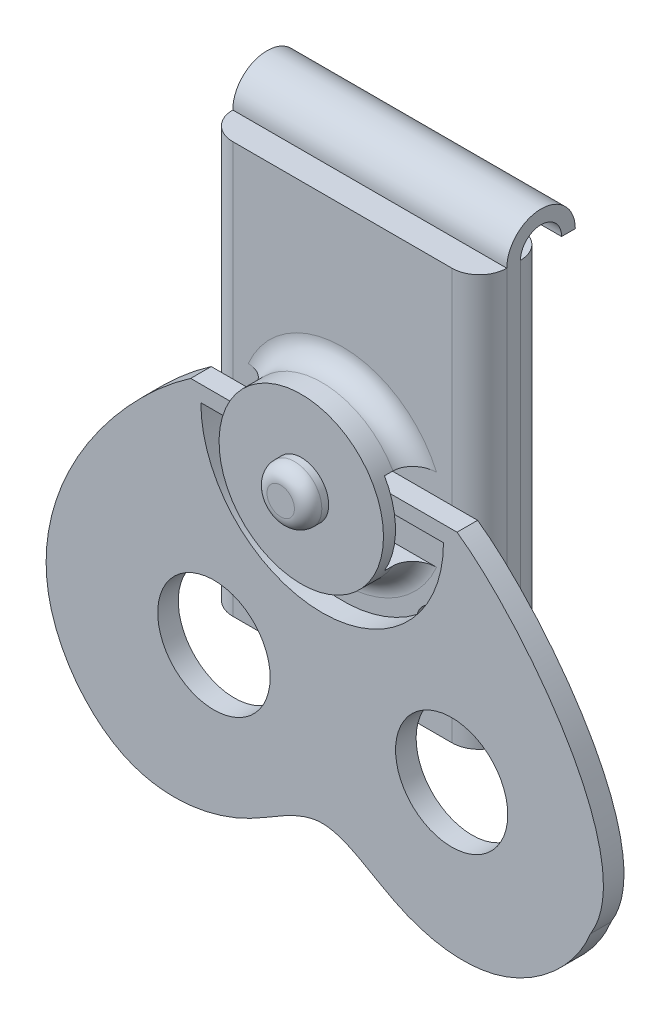
from build123d import *

# Parameters (mm, degrees)
SKETCH_1_W          = 20
SKETCH_1_H          = 30
EXTRUDE_1_DEPTH     = 5
FILLET_1_R          = 2
SKETCH_3_R          = 6
EXTRUDE_2_DEPTH     = 3
SKETCH_6_R          = 2
EXTRUDE_3_DEPTH     = 1.5
FILLET_2_R          = 1
FILLET_3_R          = 1.5
CUT_EXTRUDE_2_REACH = 26.29
SKETCH_8_W          = 2.123495481
SKETCH_8_H          = 6
EXTRUDE_4_DEPTH     = 1.5
SKETCH_11_R         = 4.102803396
SKETCH_11_R_2       = 4.093881939
CUT_EXTRUDE_4_DEPTH = 1.5
CUT_EXTRUDE_5_REACH = 41.076
SKETCH_12_R         = 1.6
SKETCH_15_W         = 20
SKETCH_15_H         = 1


with BuildPart() as part:
    # 草图1 → 凸台-拉伸1 (new body)
    with BuildSketch(Plane.XY):
        with Locations((-0.512048193, -4.728915663)):
            Rectangle(SKETCH_1_W, SKETCH_1_H)
    extrude(amount=EXTRUDE_1_DEPTH)

    # 圆角1
    fillet_1_edges = [part.edges().sort_by_distance(p)[0] for p in [
        (9.487951807, -4.728915663, 5),
        (-10.512048193, -4.728915663, 5),
        (9.487951807, -4.728915663, 0),
        (-10.512048193, -4.728915663, 0),
    ]]
    fillet(fillet_1_edges, radius=FILLET_1_R)

    # 草图3 → 凸台-拉伸2 (add)
    with BuildSketch(Plane.XY.offset(5)):
        with Locations((-0.512048193, -6.192161846)):
            Circle(SKETCH_3_R)
    extrude(amount=EXTRUDE_2_DEPTH)

    # 草图6 → 凸台-拉伸3 (add)
    with BuildSketch(Plane.XY.offset(8)):
        with Locations((-0.512048193, -6.192161846)):
            Circle(SKETCH_6_R)
    extrude(amount=EXTRUDE_3_DEPTH)

    # 圆角2
    fillet_2_edges = [part.edges().sort_by_distance(p)[0] for p in [
        (-2.512048193, -6.192161846, 9.5),
    ]]
    fillet(fillet_2_edges, radius=FILLET_2_R)

    # 圆角3
    fillet_3_edges = [part.edges().sort_by_distance(p)[0] for p in [
        (-6.512048193, -6.192161846, 5),
    ]]
    fillet(fillet_3_edges, radius=FILLET_3_R)

    # 草图8 → 切除-拉伸2 (cut, up to next)
    with BuildSketch(Plane(origin=(0, 0, 0), x_dir=(0, 0, -1), z_dir=(1, 0, 0)), mode=Mode.PRIVATE) as cut_extrude_2_sk1:
        with Locations((-6.061747741, -6.192161846)):
            Rectangle(SKETCH_8_W, SKETCH_8_H)
    cut_extrude_2_tool1 = extrude(cut_extrude_2_sk1.sketch, amount=-CUT_EXTRUDE_2_REACH, mode=Mode.PRIVATE) & part.part
    cut_extrude_2 = cut_extrude_2_tool1.solids().sort_by_distance((0, -6.192162, 6.061748))[0]
    add(cut_extrude_2, mode=Mode.SUBTRACT)

    # 镜向1: 切除-拉伸2 across plane
    add(cut_extrude_2.mirror(Plane(origin=(0, 0, 0), x_dir=(0, 0, 1), z_dir=(1, 0, 0))), mode=Mode.SUBTRACT)

    # 草图10 → 凸台-拉伸4 (add)
    with BuildSketch(Plane.XY.offset(5)):
        with BuildLine():
            Line((-9.340987134, -4.728915663), (9.355589447, -4.728915663))
            add(Edge.make_bspline(
                [(9.355589447, -4.728915663), (13.992546716, -7.945382006), (22.972097945, -19.096110537), (19.084733928, -25.255580428)],
                knots=[0, 0, 0, 0, 0.887388337, 0.887388337, 0.887388337, 0.887388337], degree=3))
            add(Edge.make_bspline(
                [(-10.082914776, -4.728915663), (-15.408926962, -8.375968451), (-24.994806931, -20.22138181), (-15.197101736, -32.678561916), (-6.587465976, -31.626421296), (-0.477412243, -26.61445571), (5.414794623, -31.424474746), (13.293093494, -32.294100029), (18.097699513, -27.767163892), (19.084733928, -25.255580428)],
                knots=[0, 0, 0, 0, 0.234068199, 0.319051753, 0.409665551, 0.46874826, 0.52865283, 0.608525839, 0.694487997, 0.694487997, 0.694487997, 0.694487997], degree=3))
            Line((-10.082914776, -4.728915663), (-9.340987134, -4.728915663))
        make_face()
        with BuildLine():
            Line((-9.340987134, -5.891268969), (8.366352591, -5.891268969))
            ThreePointArc((8.366352591, -5.891268969), (-0.487317271, -14.744938831), (-9.340987134, -5.891268969))
        make_face(mode=Mode.SUBTRACT)
    extrude(amount=EXTRUDE_4_DEPTH)

    # 草图11 → 切除-拉伸4 (cut)
    with BuildSketch(Plane.XY.offset(6.5)):
        with Locations((-8.385806573, -20.733892602)):
            Circle(SKETCH_11_R)
        with Locations((8.963204082, -20.733892602)):
            Circle(SKETCH_11_R_2)
    extrude(amount=-CUT_EXTRUDE_4_DEPTH, mode=Mode.SUBTRACT)

    # 切除-拉伸5: up to this face of the body (flat: up to its plane)
    cut_extrude_5_end = Plane(part.part.faces().sort_by_distance((-0.492684215, -8.944423167, 5))[0])
    # 草图12 → 切除-拉伸5 (cut, up to the picked face)
    with BuildSketch(Plane(origin=(0, 0, 0), x_dir=(-1, 0, 0), z_dir=(0, 0, -1)), mode=Mode.PRIVATE) as cut_extrude_5_sk1:
        with Locations(Location((-6.487951807, -13.298602321, 0), (0, 0, 231.317812547))):
            Circle(SKETCH_12_R)
    cut_extrude_5_tool1 = split(extrude(cut_extrude_5_sk1.sketch, amount=-CUT_EXTRUDE_5_REACH, mode=Mode.PRIVATE), bisect_by=cut_extrude_5_end, keep=Keep.BOTH, mode=Mode.PRIVATE)
    # 草图12 → 切除-拉伸5 (cut, up to the picked face)
    with BuildSketch(Plane(origin=(0, 0, 0), x_dir=(-1, 0, 0), z_dir=(0, 0, -1)), mode=Mode.PRIVATE) as cut_extrude_5_sk2:
        with Locations(Location((7.512048193, -13.298602321, 0), (0, 0, 308.682187453))):
            Circle(SKETCH_12_R)
    cut_extrude_5_tool2 = split(extrude(cut_extrude_5_sk2.sketch, amount=-CUT_EXTRUDE_5_REACH, mode=Mode.PRIVATE), bisect_by=cut_extrude_5_end, keep=Keep.BOTH, mode=Mode.PRIVATE)
    add(cut_extrude_5_tool1.solids().sort_by(Axis((6.487952, -13.298602, 0), (0, 0, 1)))[0], mode=Mode.SUBTRACT)
    add(cut_extrude_5_tool2.solids().sort_by(Axis((-7.512048, -13.298602, 0), (0, 0, 1)))[0], mode=Mode.SUBTRACT)

    # 扫描1: sweep along a path in 草图14
    with BuildLine(Plane(origin=(0, 0, 0), x_dir=(0, 0, -1), z_dir=(1, 0, 0))) as sweep_1_path:
        ThreePointArc((-2.5, 10.271084337), (-0.5, 12.271084337), (1.5, 10.271084337))
    # 草图15 → 扫描1 (sweep)
    with BuildSketch(Plane(origin=(0, 10.271084337, 0), x_dir=(1, 0, 0), z_dir=(0, 1, 0))):
        with Locations((-0.512048193, -2.5)):
            Rectangle(SKETCH_15_W, SKETCH_15_H)
    sweep(path=sweep_1_path.line)


solid = part.part
